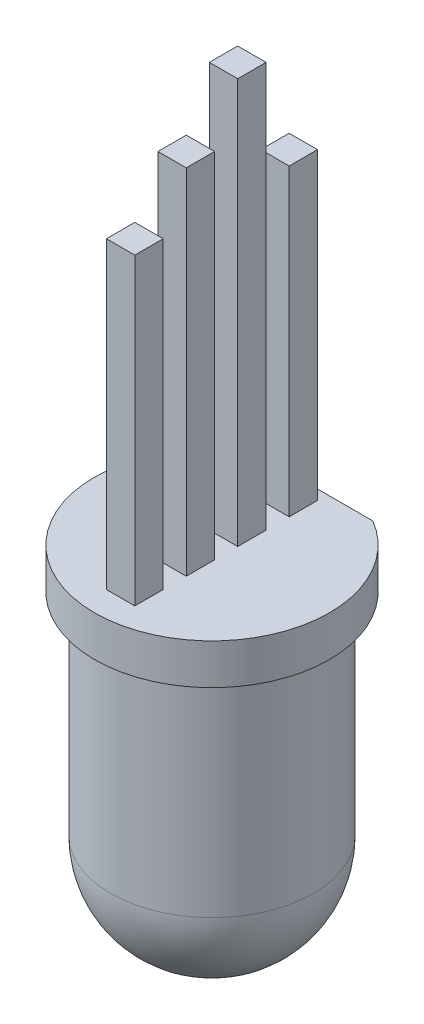
from build123d import *

# Parameters (mm, degrees)
ENL_V_MAT_EXTRU_1_REACH = 10.724
ESQUISSE3_W             = 0.7
ESQUISSE3_H             = 0.7
BOSS_EXTRU_1_DEPTH      = 10
ENL_V_START             = -3.25
ENL_V_MAT_EXTRU_2_DEPTH = 5.8


with BuildPart() as part:
    # Esquisse1 → Révolution1 (revolve)
    with BuildSketch(Plane.XY):
        with BuildLine():
            Line((2.5, 7.7), (2.5, 2.5))
            ThreePointArc((2.5, 2.5), (1.767766953, 0.732233047), (0, 0))
            Line((0, 0), (0, 8.7))
            Line((0, 8.7), (2.9, 8.7))
            Line((2.9, 8.7), (2.9, 7.7))
            Line((2.9, 7.7), (2.5, 7.7))
        make_face()
    revolve(axis=Axis((0, 0, 0), (0, 1, 0)))

    # Esquisse2 → Enlèv. mat.-Extru.1 (cut, up to next)
    with BuildSketch(Plane(origin=(0, 7.7, 0), x_dir=(-1, 0, 0), z_dir=(0, -1, 0)), mode=Mode.PRIVATE) as enl_v_mat_extru_1_sk1:
        Polygon((2.031643218, 2.5), (-2.119175806, 2.5), (-0.304277426, 5.41579693), align=None)
    enl_v_mat_extru_1_tool1 = extrude(enl_v_mat_extru_1_sk1.sketch, amount=-ENL_V_MAT_EXTRU_1_REACH, mode=Mode.PRIVATE) & part.part
    add(enl_v_mat_extru_1_tool1.solids().sort_by_distance((0.130603, 7.7, -3.471932))[0], mode=Mode.SUBTRACT)

    # Esquisse3 → Boss.-Extru.1 (add)
    with BuildSketch(Plane(origin=(0, 8.7, 0), x_dir=(1, 0, 0), z_dir=(0, 1, 0))):
        with Locations((0, 1.905)):
            Rectangle(ESQUISSE3_W, ESQUISSE3_H)
        with Locations((0, -0.635)):
            Rectangle(ESQUISSE3_W, ESQUISSE3_H)
        with Locations((0, -1.905)):
            Rectangle(ESQUISSE3_W, ESQUISSE3_H)
        with Locations((0, 0.635)):
            Rectangle(ESQUISSE3_W, ESQUISSE3_H)
    extrude(amount=BOSS_EXTRU_1_DEPTH)

    # Esquisse4 → Enlèv. mat.-Extru.2 (cut)
    with BuildSketch(Plane.ZY.offset(0.35).offset(ENL_V_START)):
        Polygon((-2.885095567, 16.2), (-1.265657514, 16.2), (-1.265657514, 33.921907916), (0, 33.921907916), (0, 17.43), (1.344412991, 17.43), (1.344412991, 16.2), (2.897512796, 16.2), (2.897512796, 34.676886987), (-2.885095567, 34.676886987), align=None)
    extrude(amount=ENL_V_MAT_EXTRU_2_DEPTH, mode=Mode.SUBTRACT)


solid = part.part
